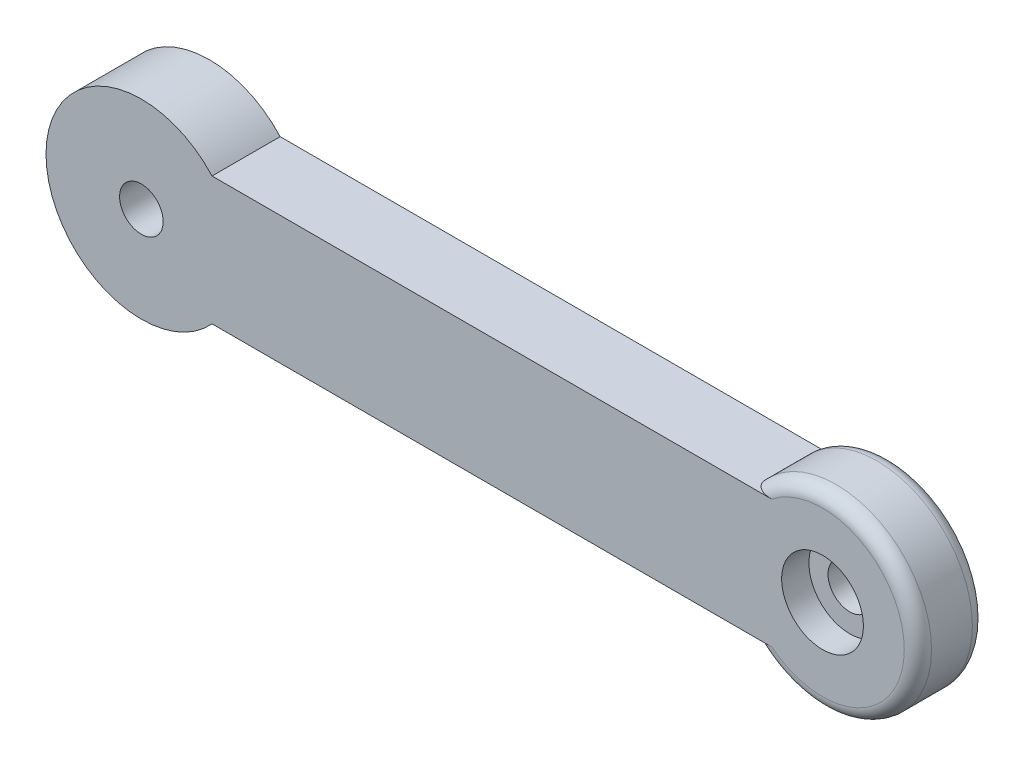
from build123d import *

# Parameters (mm, degrees)
SKETCH1_R           = 1.6
BOSS_EXTRUDE1_DEPTH = 5
SKETCH2_R           = 3
CUT_EXTRUDE1_DEPTH  = 2
BOSS_EXTRUDE2_START = -5
SKETCH3_R           = 7
SKETCH3_R_2         = 4.7
BOSS_EXTRUDE2_DEPTH = 5
FILLET1_R           = 1


with BuildPart() as part:
    # Sketch1 → Boss-Extrude1 (new body)
    with BuildSketch(Plane.XY):
        with BuildLine():
            ThreePointArc((0, 4.7), (-4.7, 0), (0, -4.7))
            Line((0, -4.7), (50, -4.7))
            ThreePointArc((50, -4.7), (54.7, 0), (50, 4.7))
            Line((50, 4.7), (0, 4.7))
        make_face()
        Circle(SKETCH1_R, mode=Mode.SUBTRACT)
        with Locations((50, 0)):
            Circle(SKETCH1_R, mode=Mode.SUBTRACT)
    extrude(amount=BOSS_EXTRUDE1_DEPTH)

    # Sketch2 → Cut-Extrude1 (cut)
    with BuildSketch(Plane.XY.offset(5)):
        with Locations((50, 0)):
            Circle(SKETCH2_R)
    extrude(amount=-CUT_EXTRUDE1_DEPTH, mode=Mode.SUBTRACT)

    # Sketch3 → Boss-Extrude2 (add)
    # profile 1 of 2: a face of its own
    with BuildSketch(Plane.XY.offset(5).offset(BOSS_EXTRUDE2_START)):
        with Locations((50, 0)):
            Circle(SKETCH3_R)
        with Locations((50, 0)):
            Circle(SKETCH3_R_2, mode=Mode.SUBTRACT)
    # profile 2 of 2: a face of its own
    with BuildSketch(Plane.XY.offset(5).offset(BOSS_EXTRUDE2_START)):
        Circle(SKETCH3_R)
        Circle(SKETCH3_R_2, mode=Mode.SUBTRACT)
    extrude(amount=BOSS_EXTRUDE2_DEPTH)

    # Fillet1
    fillet1_edges = [part.edges().sort_by_distance(p)[0] for p in [
        (57, 0, 5),
        (57, 0, 0),
    ]]
    fillet(fillet1_edges, radius=FILLET1_R)


solid = part.part
